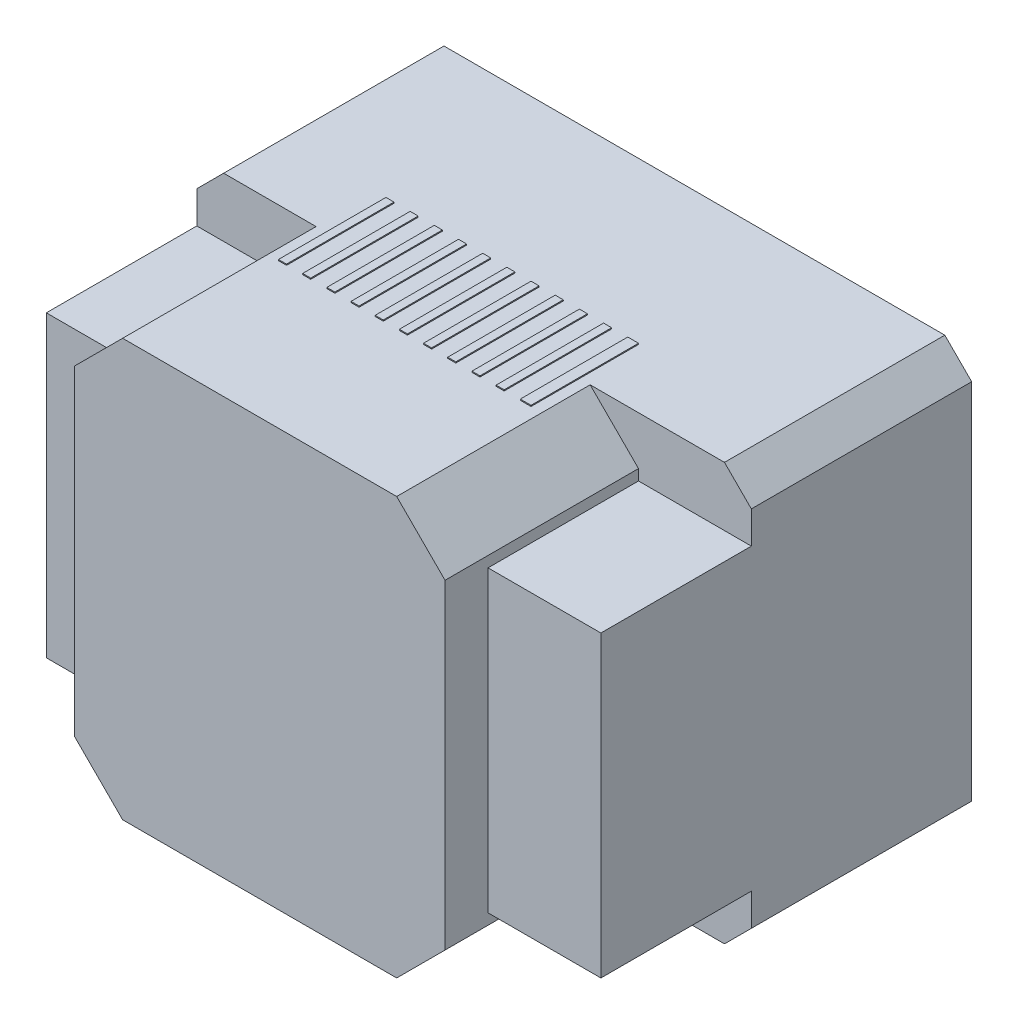
from build123d import *

# Parameters (mm, degrees)
SKETCH1_W           = 51.6
SKETCH1_H           = 38.8
BOSS_EXTRUDE1_DEPTH = 20.5
SKETCH2_W           = 51.6
SKETCH2_H           = 27.8
BOSS_EXTRUDE2_DEPTH = 14
SKETCH3_W           = 34.5
SKETCH3_H           = 38.8
BOSS_EXTRUDE3_DEPTH = 18
SKETCH4_W           = 0.75
SKETCH4_H           = 10
SKETCH4_W_2         = 1
BOSS_EXTRUDE4_DEPTH = 0.1
CHAMFER1_SIZE       = 2.5
CHAMFER2_SIZE       = 4.5


with BuildPart() as part:
    # Sketch1 → Boss-Extrude1 (new body)
    with BuildSketch(Plane.XY):
        Rectangle(SKETCH1_W, SKETCH1_H)
    extrude(amount=BOSS_EXTRUDE1_DEPTH)

    # Sketch2 → Boss-Extrude2 (add)
    with BuildSketch(Plane.XY.offset(20.5)):
        Rectangle(SKETCH2_W, SKETCH2_H)
    extrude(amount=BOSS_EXTRUDE2_DEPTH)

    # Sketch3 → Boss-Extrude3 (add)
    with BuildSketch(Plane.XY.offset(20.5)):
        with Locations((-1.95, 0)):
            Rectangle(SKETCH3_W, SKETCH3_H)
    extrude(amount=BOSS_EXTRUDE3_DEPTH)

    # Sketch4 → Boss-Extrude4 (add)
    with BuildSketch(Plane.XZ.offset(19.4)):
        with Locations((-13.325, 20)):
            Rectangle(SKETCH4_W, SKETCH4_H)
        with Locations((-11.075, 20)):
            Rectangle(SKETCH4_W, SKETCH4_H)
        with Locations((-8.825, 20)):
            Rectangle(SKETCH4_W, SKETCH4_H)
        with Locations((-6.575, 20)):
            Rectangle(SKETCH4_W, SKETCH4_H)
        with Locations((-4.325, 20)):
            Rectangle(SKETCH4_W, SKETCH4_H)
        with Locations((-2.075, 20)):
            Rectangle(SKETCH4_W, SKETCH4_H)
        with Locations((0.175, 20)):
            Rectangle(SKETCH4_W, SKETCH4_H)
        with Locations((2.425, 20)):
            Rectangle(SKETCH4_W, SKETCH4_H)
        with Locations((4.675, 20)):
            Rectangle(SKETCH4_W, SKETCH4_H)
        with Locations((6.925, 20)):
            Rectangle(SKETCH4_W, SKETCH4_H)
        with Locations((9.3, 20)):
            Rectangle(SKETCH4_W_2, SKETCH4_H)
    boss_extrude4 = extrude(amount=BOSS_EXTRUDE4_DEPTH)

    # Mirror1: Boss-Extrude4 across plane
    add(boss_extrude4.mirror(Plane.ZX))

    # Chamfer1
    chamfer1_edges = [part.edges().sort_by_distance(p)[0] for p in [
        (25.8, -19.4, 10.25),
        (-25.8, 19.4, 10.25),
        (-25.8, -19.4, 10.25),
        (25.8, 19.4, 10.25),
    ]]
    chamfer(chamfer1_edges, length=CHAMFER1_SIZE)

    # Chamfer2
    chamfer2_edges = [part.edges().sort_by_distance(p)[0] for p in [
        (-19.2, -19.4, 29.5),
        (15.3, -19.4, 29.5),
        (-19.2, 19.4, 29.5),
        (15.3, 19.4, 29.5),
    ]]
    chamfer(chamfer2_edges, length=CHAMFER2_SIZE)


solid = part.part
